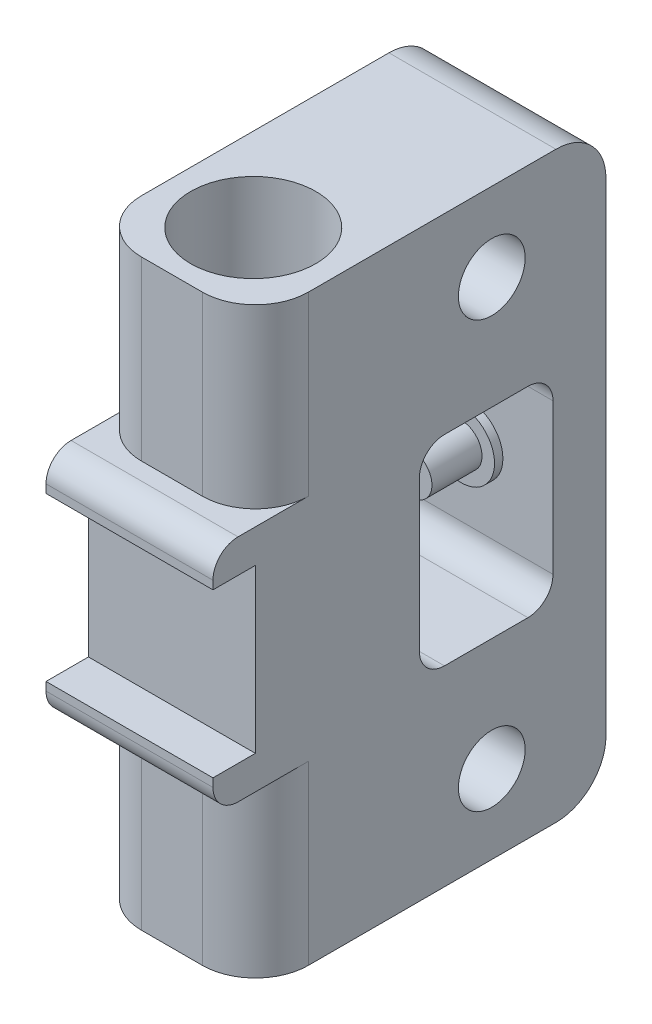
from build123d import *

# Parameters (mm, degrees)
SKETCH1_W           = 20
SKETCH1_H           = 42
BOSS_EXTRUDE1_DEPTH = 69.85
FILLET1_R           = 6.35
SKETCH3_W           = 42
SKETCH3_H           = 42
BOSS_EXTRUDE2_DEPTH = 6.35
SKETCH4_W           = 16
SKETCH4_H           = 24
CUT_EXTRUDE2_DEPTH  = 80.252902155
SKETCH8_R           = 4
CUT_EXTRUDE5_DEPTH  = 80.252902155
FILLET2_R           = 6
FILLET3_R           = 4
FILLET4_R           = 3
SKETCH9_W           = 11
SKETCH9_H           = 42
CUT_EXTRUDE6_DEPTH  = 85.166635314
SKETCH10_R          = 4.000000001
BOSS_EXTRUDE3_DEPTH = 1
SKETCH11_R          = 2.5
BOSS_EXTRUDE4_DEPTH = 6
SKETCH12_W          = 20
SKETCH12_H          = 27.5
BOSS_EXTRUDE5_DEPTH = 6.35
SKETCH13_W          = 20
SKETCH13_H          = 4
BOSS_EXTRUDE6_DEPTH = 5.08
SKETCH2_R           = 7.5
CUT_EXTRUDE1_DEPTH  = 76.227580713
FILLET5_R           = 3


with BuildPart() as part:
    # Sketch1 → Boss-Extrude1 (new body)
    with BuildSketch(Plane(origin=(0, 0, 0), x_dir=(1, 0, 0), z_dir=(0, 1, 0))):
        Rectangle(SKETCH1_W, SKETCH1_H)
    extrude(amount=BOSS_EXTRUDE1_DEPTH)

    # Fillet1
    fillet1_edges = [part.edges().sort_by_distance(p)[0] for p in [
        (10, 34.925, 21),
        (-10, 34.925, 21),
    ]]
    fillet(fillet1_edges, radius=FILLET1_R)

    # Sketch3 → Boss-Extrude2 (add)
    with BuildSketch(Plane(origin=(0, 0, -21), x_dir=(-1, 0, 0), z_dir=(0, 0, -1))):
        with Locations((0, 34.925)):
            Rectangle(SKETCH3_W, SKETCH3_H)
    extrude(amount=-BOSS_EXTRUDE2_DEPTH)

    # Sketch4 → Cut-Extrude2 (cut, through all)
    with BuildSketch(Plane(origin=(10, 0, 0), x_dir=(0, 0, -1), z_dir=(1, 0, 0))):
        with Locations((6.65, 34.925)):
            Rectangle(SKETCH4_W, SKETCH4_H)
    extrude(amount=-CUT_EXTRUDE2_DEPTH, mode=Mode.SUBTRACT)

    # Sketch8 → Cut-Extrude5 (cut, through all)
    with BuildSketch(Plane(origin=(10, 0, 0), x_dir=(0, 0, -1), z_dir=(1, 0, 0))):
        with Locations((7.318215362, 60.425)):
            Circle(SKETCH8_R)
        with Locations((7.318215362, 9.425)):
            Circle(SKETCH8_R)
    extrude(amount=-CUT_EXTRUDE5_DEPTH, mode=Mode.SUBTRACT)

    # Fillet2
    fillet2_edges = [part.edges().sort_by_distance(p)[0] for p in [
        (0, 0, -21),
        (0, 69.85, -21),
    ]]
    fillet(fillet2_edges, radius=FILLET2_R)

    # Fillet3
    fillet3_edges = [part.edges().sort_by_distance(p)[0] for p in [
        (-21, 13.925, -17.825),
        (21, 55.925, -17.825),
        (-21, 55.925, -17.825),
        (21, 13.925, -17.825),
    ]]
    fillet(fillet3_edges, radius=FILLET3_R)

    # Fillet4
    fillet4_edges = [part.edges().sort_by_distance(p)[0] for p in [
        (0, 22.925, 1.35),
        (0, 46.925, -14.65),
        (0, 22.925, -14.65),
        (0, 46.925, 1.35),
    ]]
    fillet(fillet4_edges, radius=FILLET4_R)

    # Sketch9 → Cut-Extrude6 (cut, through all)
    with BuildSketch(Plane(origin=(0, 0, -21), x_dir=(-1, 0, 0), z_dir=(0, 0, -1))):
        with Locations((-15.5, 34.925)):
            Rectangle(SKETCH9_W, SKETCH9_H)
        with Locations((15.5, 34.925)):
            Rectangle(SKETCH9_W, SKETCH9_H)
    extrude(amount=-CUT_EXTRUDE6_DEPTH, mode=Mode.SUBTRACT)

    # Sketch10 → Boss-Extrude3 (add)
    with BuildSketch(Plane.XY.offset(-14.65)):
        with Locations((0, 34.925)):
            Circle(SKETCH10_R)
    extrude(amount=BOSS_EXTRUDE3_DEPTH)

    # Sketch11 → Boss-Extrude4 (add)
    with BuildSketch(Plane.XY.offset(-13.65)):
        with Locations((0, 34.925)):
            Circle(SKETCH11_R)
    extrude(amount=BOSS_EXTRUDE4_DEPTH)

    # Sketch12 → Boss-Extrude5 (add)
    with BuildSketch(Plane.XY.offset(21)):
        with Locations((0, 34.925)):
            Rectangle(SKETCH12_W, SKETCH12_H)
    extrude(amount=-BOSS_EXTRUDE5_DEPTH)

    # Sketch13 → Boss-Extrude6 (add)
    with BuildSketch(Plane.XY.offset(21)):
        with Locations((0, 46.675)):
            Rectangle(SKETCH13_W, SKETCH13_H)
        with Locations((0, 23.175)):
            Rectangle(SKETCH13_W, SKETCH13_H)
    extrude(amount=BOSS_EXTRUDE6_DEPTH)

    # Sketch2 → Cut-Extrude1 (cut, through all)
    with BuildSketch(Plane(origin=(0, 69.85, 0), x_dir=(1, 0, 0), z_dir=(0, 1, 0))):
        with Locations(Location((0, -11.254449914, 0), (0, 0, 270))):
            Circle(SKETCH2_R)
    extrude(amount=-CUT_EXTRUDE1_DEPTH, mode=Mode.SUBTRACT)

    # Fillet5
    fillet5_edges = [part.edges().sort_by_distance(p)[0] for p in [
        (0, 21.175, 26.08),
        (0, 48.675, 26.08),
    ]]
    fillet(fillet5_edges, radius=FILLET5_R)


solid = part.part
